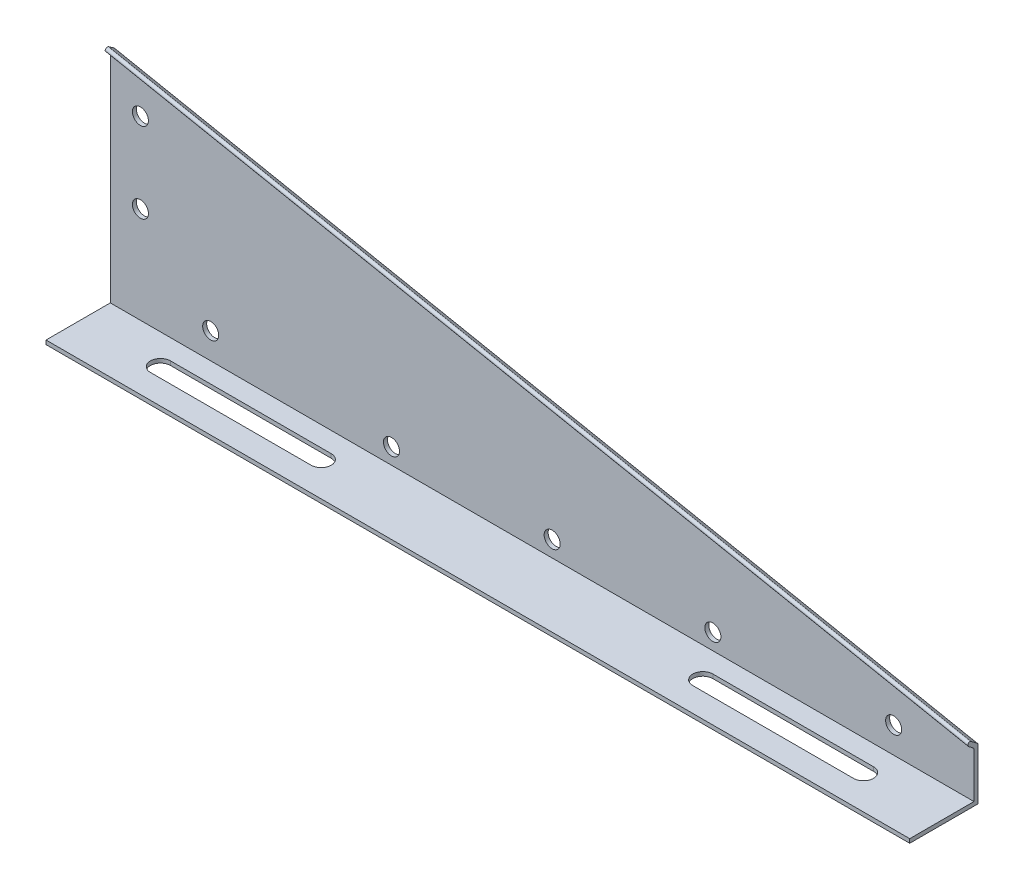
from build123d import *

# Parameters (mm, degrees)
BOSS_EXTRUDE1_DEPTH = 2
SKETCH3_W           = 430
SKETCH3_H           = 2
BOSS_EXTRUDE2_DEPTH = 30
CUT_EXTRUDE1_DEPTH  = 50
SKETCH7_R           = 4
CUT_EXTRUDE2_DEPTH  = 445.998876403
SKETCH8_R           = 4
CUT_EXTRUDE3_DEPTH  = 445.998876403
BOSS_EXTRUDE4_REACH = 466.157
FILLET3_R           = 1
FILLET4_R           = 1
SKETCH14_W          = 14.198164628
SKETCH14_H          = 140.679364316
CUT_EXTRUDE6_DEPTH  = 446.935341302


with BuildPart() as part:
    # Sketch2 → Boss-Extrude1 (new body)
    with BuildSketch(Plane.XY):
        Polygon((0, 0), (430, 0), (430, 25), (0, 110), align=None)
    boss_extrude1 = extrude(amount=BOSS_EXTRUDE1_DEPTH)

    # Sketch3 → Boss-Extrude2 (add)
    with BuildSketch(Plane(origin=(0, 0, 0), x_dir=(-1, 0, 0), z_dir=(0, 0, -1))):
        with Locations((-215, 1)):
            Rectangle(SKETCH3_W, SKETCH3_H)
    extrude(amount=BOSS_EXTRUDE2_DEPTH)

    # Sketch4 → Cut-Extrude1 (cut)
    with BuildSketch(Plane(origin=(0, 2, 0), x_dir=(1, 0, 0), z_dir=(0, 1, 0))):
        with BuildLine():
            Line((40, 20), (120, 20))
            ThreePointArc((120, 20), (125, 15), (120, 10))
            Line((120, 10), (40, 10))
            ThreePointArc((40, 10), (35, 15), (40, 20))
        make_face()
        with BuildLine():
            Line((390, 20), (310, 20))
            ThreePointArc((310, 20), (305, 15), (310, 10))
            Line((310, 10), (390, 10))
            ThreePointArc((390, 10), (395, 15), (390, 20))
        make_face()
    extrude(amount=-CUT_EXTRUDE1_DEPTH, mode=Mode.SUBTRACT)

    # Sketch7 → Cut-Extrude2 (cut, through all)
    with BuildSketch(Plane.XY.offset(2)):
        with Locations((15, 50)):
            Circle(SKETCH7_R)
        with Locations((50, 15)):
            Circle(SKETCH7_R)
        with Locations((390, 15)):
            Circle(SKETCH7_R)
        with Locations((15, 90)):
            Circle(SKETCH7_R)
    cut_extrude2 = extrude(amount=-CUT_EXTRUDE2_DEPTH, mode=Mode.SUBTRACT)

    # Sketch8 → Cut-Extrude3 (cut, through all)
    with BuildSketch(Plane.XY.offset(2)):
        with Locations((140, 10)):
            Circle(SKETCH8_R)
        with Locations((220, 10)):
            Circle(SKETCH8_R)
        with Locations((300, 10)):
            Circle(SKETCH8_R)
    cut_extrude3 = extrude(amount=-CUT_EXTRUDE3_DEPTH, mode=Mode.SUBTRACT)

    # Boss-Extrude4: up to this plane
    boss_extrude4_end = Plane(origin=(430, 0, 2), z_dir=(-1, 0, 0))
    # Sketch12 → Boss-Extrude4 (add, up to the surface)
    with BuildSketch(Plane(origin=(-20.926480156, 4.136629798, 0), x_dir=(0, 0, -1), z_dir=(0.9810169593645325, -0.19392195708368665, 0)), mode=Mode.PRIVATE) as boss_extrude4_sk1:
        with BuildLine():
            Line((2.668468057, 109.913216573), (0, 107.91186553))
            Line((0, 107.91186553), (-2, 107.91186553))
            Line((-2, 107.91186553), (-2, 108.91186553))
            Line((-2, 108.91186553), (1.468468057, 111.513216573))
            ThreePointArc((1.468468057, 111.513216573), (2.868468057, 111.313216573), (2.668468057, 109.913216573))
        make_face()
    boss_extrude4_tool1 = split(extrude(boss_extrude4_sk1.sketch, amount=BOSS_EXTRUDE4_REACH, mode=Mode.PRIVATE), bisect_by=boss_extrude4_end, keep=Keep.BOTH, mode=Mode.PRIVATE)
    boss_extrude4 = boss_extrude4_tool1.solids().sort_by_distance((0.341058, 111.725355, -0.613229))[0]
    add(boss_extrude4)

    # Fillet3
    fillet3_edges = [part.edges().sort_by_distance(p)[0] for p in [
        (215.096960979, 68.500183664, 2),
        (215, 67.5, 0),
    ]]
    fillet(fillet3_edges, radius=FILLET3_R)

    # Mirror1: Boss-Extrude1 across plane
    add(boss_extrude1.mirror(Plane(origin=(0, 0, -15), x_dir=(1, 0, 0), z_dir=(0, 0, -1))))

    # Mirror2: Boss-Extrude4 across plane
    add(boss_extrude4.mirror(Plane(origin=(0, 0, -15), x_dir=(1, 0, 0), z_dir=(0, 0, -1))))

    # Fillet4
    fillet4_edges = [part.edges().sort_by_distance(p)[0] for p in [
        (215, 67.5, -30),
        (215.096960979, 68.500183664, -32),
    ]]
    fillet(fillet4_edges, radius=FILLET4_R)

    # Sketch14 → Cut-Extrude6 (cut, through all)
    with BuildSketch(Plane.ZY):
        with Locations((1.254098972, 72.339682158)):
            Rectangle(SKETCH14_W, SKETCH14_H)
    extrude(amount=-CUT_EXTRUDE6_DEPTH, mode=Mode.SUBTRACT)

    # Mirror3: Cut-Extrude2, Cut-Extrude3 across plane
    add(cut_extrude2.mirror(Plane(origin=(0, 0, -15), x_dir=(1, 0, 0), z_dir=(0, 0, -1))), mode=Mode.SUBTRACT)
    add(cut_extrude3.mirror(Plane(origin=(0, 0, -15), x_dir=(1, 0, 0), z_dir=(0, 0, -1))), mode=Mode.SUBTRACT)


solid = part.part
